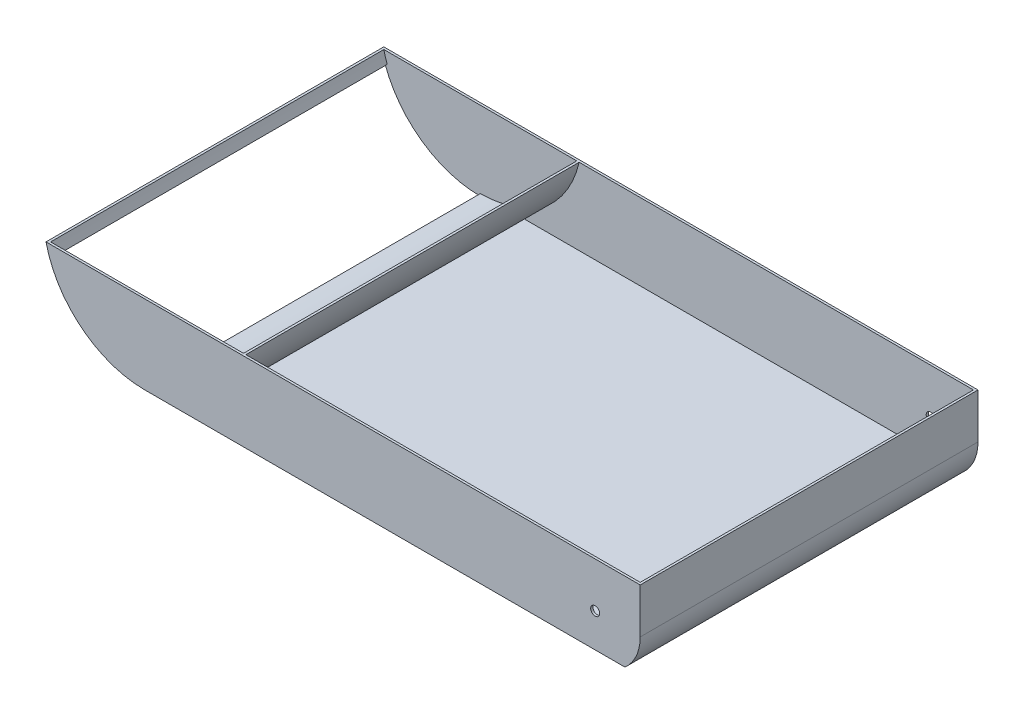
from build123d import *

# Parameters (mm, degrees)
EXTRUDE_1_DEPTH          = 300
SHELL_1_T                = -2
SKETCH_3_W               = 101.211387706
SKETCH_3_H               = 60
CUT_EXTRUDE_1_DEPTH      = 296
EXTRUDE_2_DEPTH          = 300
CUT_EXTRUDE_2_DEPTH      = 541.092584656
CUT_EXTRUDE_2_DEPTH_BACK = 541.092584656
SKETCH_6_R               = 4


with BuildPart() as part:
    # 草图1 → 凸台-拉伸1 (new body)
    with BuildSketch(Plane.XY):
        with BuildLine():
            Line((-22.839294621, -20), (-87.749643874, -20))
            ThreePointArc((-87.749643874, -20), (-56.124860802, -70.356236397), (0, -90))
            Line((0, -90), (400, -90))
            Line((400, -90), (426.457513111, -90))
            ThreePointArc((426.457513111, -90), (436.457513111, -76.457513111), (440, -60))
            Line((440, -60), (440, -20))
            Line((440, -20), (400, -20))
            Line((400, -20), (-22.839294621, -20))
        make_face()
    extrude(amount=-EXTRUDE_1_DEPTH)

    # 抽壳1
    shell_1_openings = [part.faces().sort_by_distance(p)[0] for p in [
        (176.125178063, -20, -150),
    ]]
    offset(amount=SHELL_1_T, openings=shell_1_openings, kind=Kind.INTERSECTION)

    # 草图3 → 切除-拉伸1 (cut)
    with BuildSketch(Plane.XY.offset(-298)):
        with Locations((-50.605693853, -60)):
            Rectangle(SKETCH_3_W, SKETCH_3_H)
    extrude(amount=CUT_EXTRUDE_1_DEPTH, mode=Mode.SUBTRACT)

    # 草图4 → 凸台-拉伸2 (add)
    with BuildSketch(Plane.XY):
        with BuildLine():
            Line((85.697141143, -20), (87.749643874, -20))
            ThreePointArc((87.749643874, -20), (56.124860802, -70.356236397), (0, -90))
            Line((0, -90), (0, -88))
            ThreePointArc((0, -88), (54.699177325, -68.934751758), (85.697141143, -20))
        make_face()
    extrude(amount=-EXTRUDE_2_DEPTH)

    # 草图6 → 切除-拉伸2 (cut, two sides: drawn at the far end of the back side and taken through both)
    with BuildSketch(Plane.XY.offset(-CUT_EXTRUDE_2_DEPTH_BACK)):
        with Locations((400, -60)):
            Circle(SKETCH_6_R)
    extrude(amount=CUT_EXTRUDE_2_DEPTH + CUT_EXTRUDE_2_DEPTH_BACK, mode=Mode.SUBTRACT)


solid = part.part
